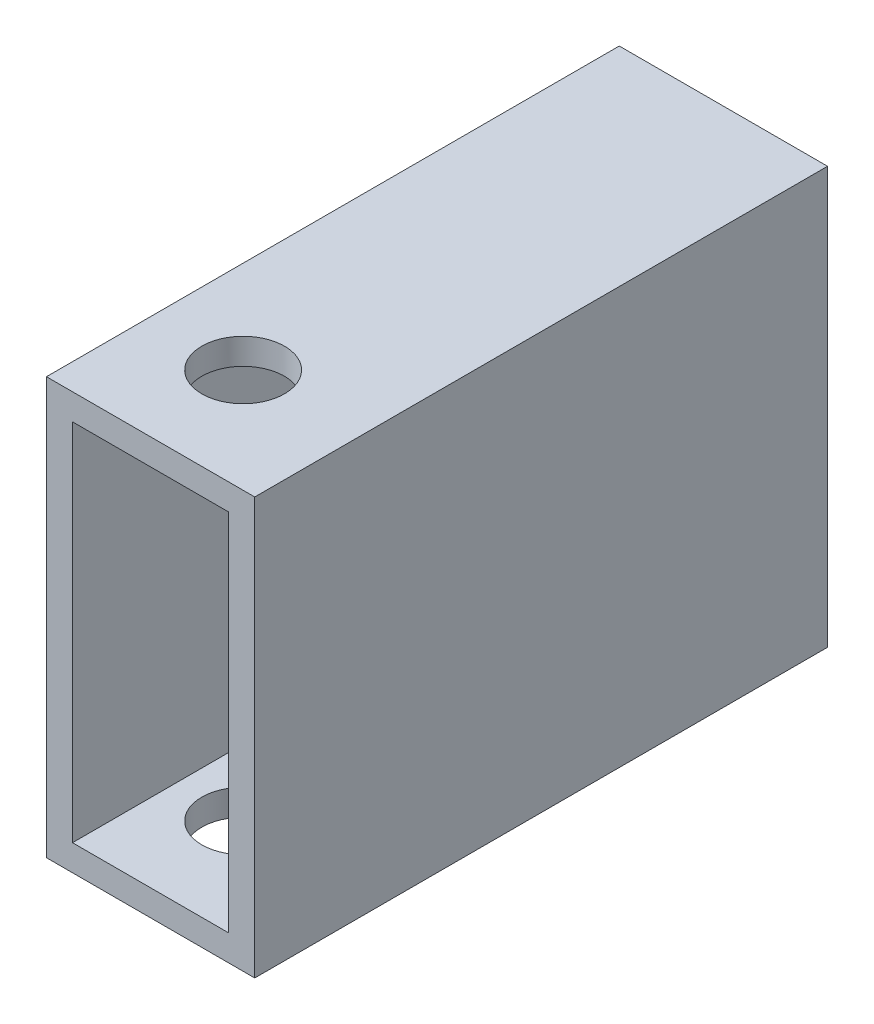
from build123d import *

# Parameters (mm, degrees)
SKETCH1_W           = 25.4
SKETCH1_H           = 50.8
SKETCH1_W_2         = 19.05
SKETCH1_H_2         = 44.45
BOSS_EXTRUDE1_DEPTH = 69.85
CUT_EXTRUDE2_REACH  = 90.652
SKETCH4_R           = 5.0419


with BuildPart() as part:
    # Sketch1 → Boss-Extrude1 (new body)
    with BuildSketch(Plane.XY):
        with Locations((-7.289349112, 6.500295858)):
            Rectangle(SKETCH1_W, SKETCH1_H)
        with Locations((-7.289349112, 6.500295858)):
            Rectangle(SKETCH1_W_2, SKETCH1_H_2, mode=Mode.SUBTRACT)
    extrude(amount=BOSS_EXTRUDE1_DEPTH)

    # Cut-Extrude2: up to this face of the body (flat: up to its plane)
    cut_extrude2_end = Plane(part.part.faces().sort_by_distance((-7.289349112, -18.899704142, 34.925))[0])
    # Sketch4 → Cut-Extrude2 (cut, up to the picked face)
    with BuildSketch(Plane(origin=(0, 31.900295858, 0), x_dir=(1, 0, 0), z_dir=(0, 1, 0)), mode=Mode.PRIVATE) as cut_extrude2_sk1:
        with Locations(Location((-8.705288844, -57.15, 0), (0, 0, 270))):
            Circle(SKETCH4_R)
    cut_extrude2_tool1 = split(extrude(cut_extrude2_sk1.sketch, amount=-CUT_EXTRUDE2_REACH, mode=Mode.PRIVATE), bisect_by=cut_extrude2_end, keep=Keep.BOTH, mode=Mode.PRIVATE)
    add(cut_extrude2_tool1.solids().sort_by(Axis((-8.705289, 31.900296, 57.15), (0, -1, 0)))[0], mode=Mode.SUBTRACT)


solid = part.part
